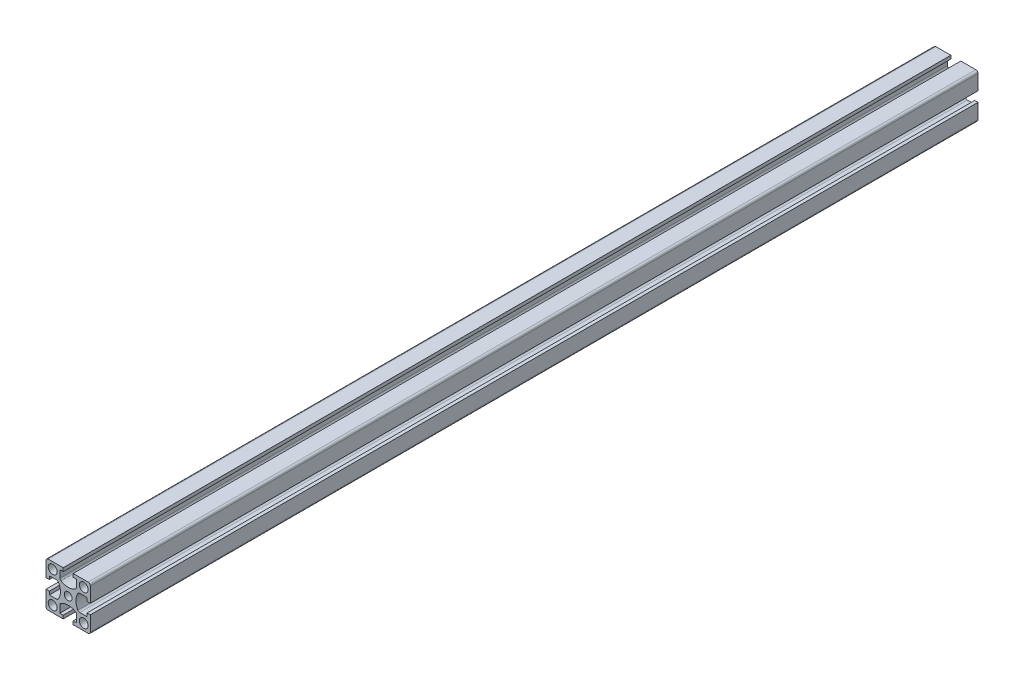
from build123d import *

# Parameters (mm, degrees)
SKETCH1_R           = 2
SKETCH1_R_2         = 1.75
BOSS_EXTRUDE1_DEPTH = 400


with BuildPart() as part:
    # Sketch1 → Boss-Extrude1 (new body)
    with BuildSketch(Plane.XY):
        with BuildLine():
            Line((-10, 9), (-10, 2.25))
            Line((-10, 2.25), (-8.5, 2.25))
            Line((-8.5, 2.25), (-8.5, 3.75))
            Line((-8.5, 3.75), (-5.236860279, 3.75))
            ThreePointArc((-5.236860279, 3.75), (-4.736860279, 3.616025404), (-4.370834875, 3.25))
            ThreePointArc((-4.370834875, 3.25), (-3.5, 0), (-4.370834875, -3.25))
            ThreePointArc((-4.370834875, -3.25), (-4.736860279, -3.616025404), (-5.236860279, -3.75))
            Line((-5.236860279, -3.75), (-8.5, -3.75))
            Line((-8.5, -3.75), (-8.5, -2.25))
            Line((-8.5, -2.25), (-10, -2.25))
            Line((-10, -2.25), (-10, -9))
            ThreePointArc((-10, -9), (-9.707106781, -9.707106781), (-9, -10))
            Line((-9, -10), (-2.25, -10))
            Line((-2.25, -10), (-2.25, -8.5))
            Line((-2.25, -8.5), (-3.75, -8.5))
            Line((-3.75, -8.5), (-3.75, -5.236860279))
            ThreePointArc((-3.75, -5.236860279), (-3.616025404, -4.736860279), (-3.25, -4.370834875))
            ThreePointArc((-3.25, -4.370834875), (0, -3.5), (3.25, -4.370834875))
            ThreePointArc((3.25, -4.370834875), (3.616025404, -4.736860279), (3.75, -5.236860279))
            Line((3.75, -5.236860279), (3.75, -8.5))
            Line((3.75, -8.5), (2.25, -8.5))
            Line((2.25, -8.5), (2.25, -10))
            Line((2.25, -10), (9, -10))
            ThreePointArc((9, -10), (9.707106781, -9.707106781), (10, -9))
            Line((10, -9), (10, -2.25))
            Line((10, -2.25), (8.5, -2.25))
            Line((8.5, -2.25), (8.5, -3.75))
            Line((8.5, -3.75), (5.236860279, -3.75))
            ThreePointArc((5.236860279, -3.75), (4.736860279, -3.616025404), (4.370834875, -3.25))
            ThreePointArc((4.370834875, -3.25), (3.5, 0), (4.370834875, 3.25))
            ThreePointArc((4.370834875, 3.25), (4.736860279, 3.616025404), (5.236860279, 3.75))
            Line((5.236860279, 3.75), (8.5, 3.75))
            Line((8.5, 3.75), (8.5, 2.25))
            Line((8.5, 2.25), (10, 2.25))
            Line((10, 2.25), (10, 9))
            ThreePointArc((10, 9), (9.707106781, 9.707106781), (9, 10))
            Line((9, 10), (2.25, 10))
            Line((2.25, 10), (2.25, 8.5))
            Line((2.25, 8.5), (3.75, 8.5))
            Line((3.75, 8.5), (3.75, 5.236860279))
            ThreePointArc((3.75, 5.236860279), (3.616025404, 4.736860279), (3.25, 4.370834875))
            ThreePointArc((3.25, 4.370834875), (0, 3.5), (-3.25, 4.370834875))
            ThreePointArc((-3.25, 4.370834875), (-3.616025404, 4.736860279), (-3.75, 5.236860279))
            Line((-3.75, 5.236860279), (-3.75, 8.5))
            Line((-3.75, 8.5), (-2.25, 8.5))
            Line((-2.25, 8.5), (-2.25, 10))
            Line((-2.25, 10), (-9, 10))
            ThreePointArc((-9, 10), (-9.707106781, 9.707106781), (-10, 9))
        make_face()
        with Locations((-7, -7)):
            Circle(SKETCH1_R, mode=Mode.SUBTRACT)
        with Locations((7, -7)):
            Circle(SKETCH1_R, mode=Mode.SUBTRACT)
        with Locations((7, 7)):
            Circle(SKETCH1_R, mode=Mode.SUBTRACT)
        Circle(SKETCH1_R_2, mode=Mode.SUBTRACT)
        with Locations((-7, 7)):
            Circle(SKETCH1_R, mode=Mode.SUBTRACT)
    extrude(amount=BOSS_EXTRUDE1_DEPTH)


solid = part.part
